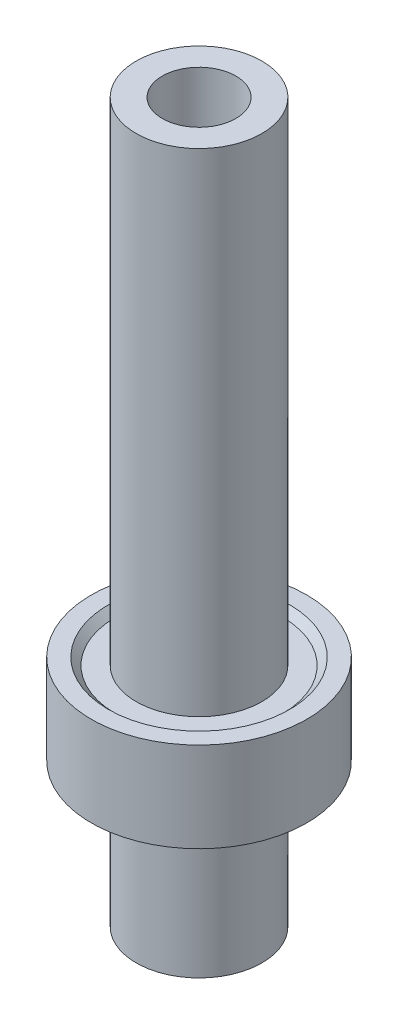
from build123d import *


with BuildPart() as part:
    # Sketch1 → Revolve1 (revolve)
    with BuildSketch(Plane(origin=(0, 0, 0), x_dir=(0, 0, -1), z_dir=(1, 0, 0))):
        Polygon((10.25, 0), (10.25, 200), (17.5, 200), (17.5, 63), (23.25, 63), (25.25, 65), (30, 65), (30, 40), (17.5, 40), (17.5, 0), align=None)
    revolve(axis=Axis((0, 0, 0), (0, 1, 0)))


solid = part.part
